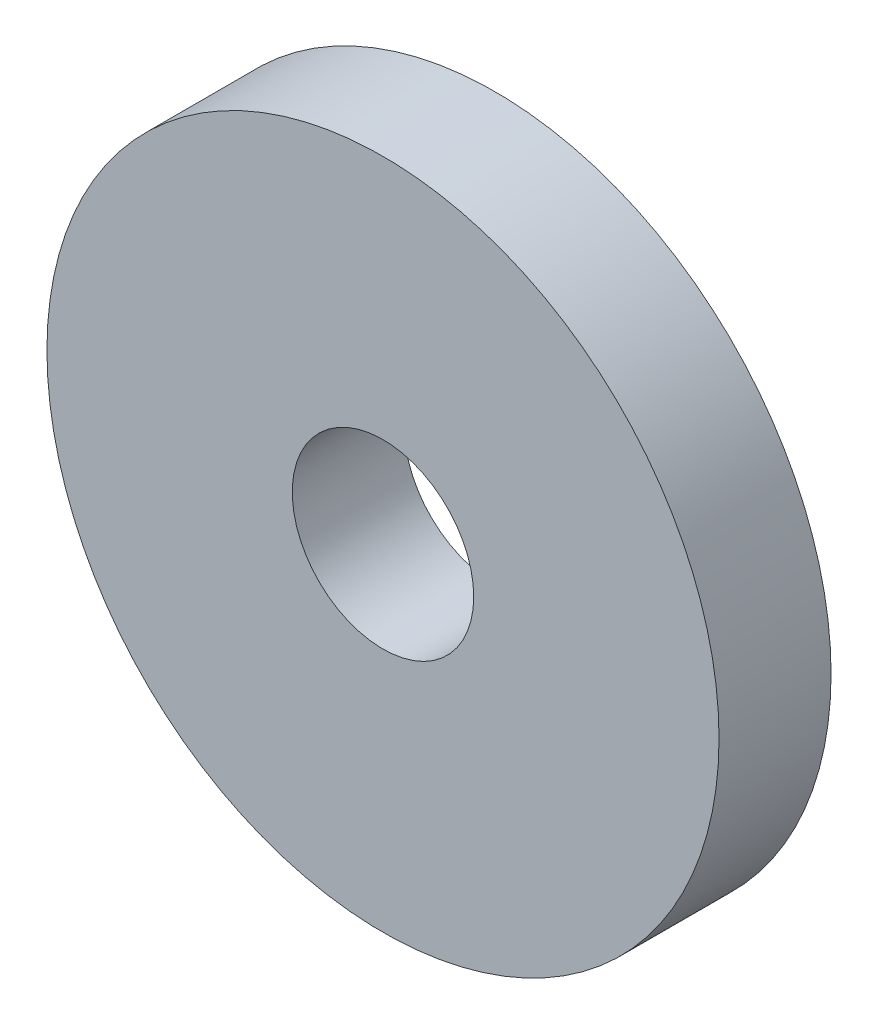
from build123d import *

# Parameters (mm, degrees)
SKETCH1_R           = 15
SKETCH1_R_2         = 4.05
BOSS_EXTRUDE1_DEPTH = 5


with BuildPart() as part:
    # Sketch1 → Boss-Extrude1 (new body)
    with BuildSketch(Plane.XY):
        Circle(SKETCH1_R)
        Circle(SKETCH1_R_2, mode=Mode.SUBTRACT)
    extrude(amount=BOSS_EXTRUDE1_DEPTH)


solid = part.part
